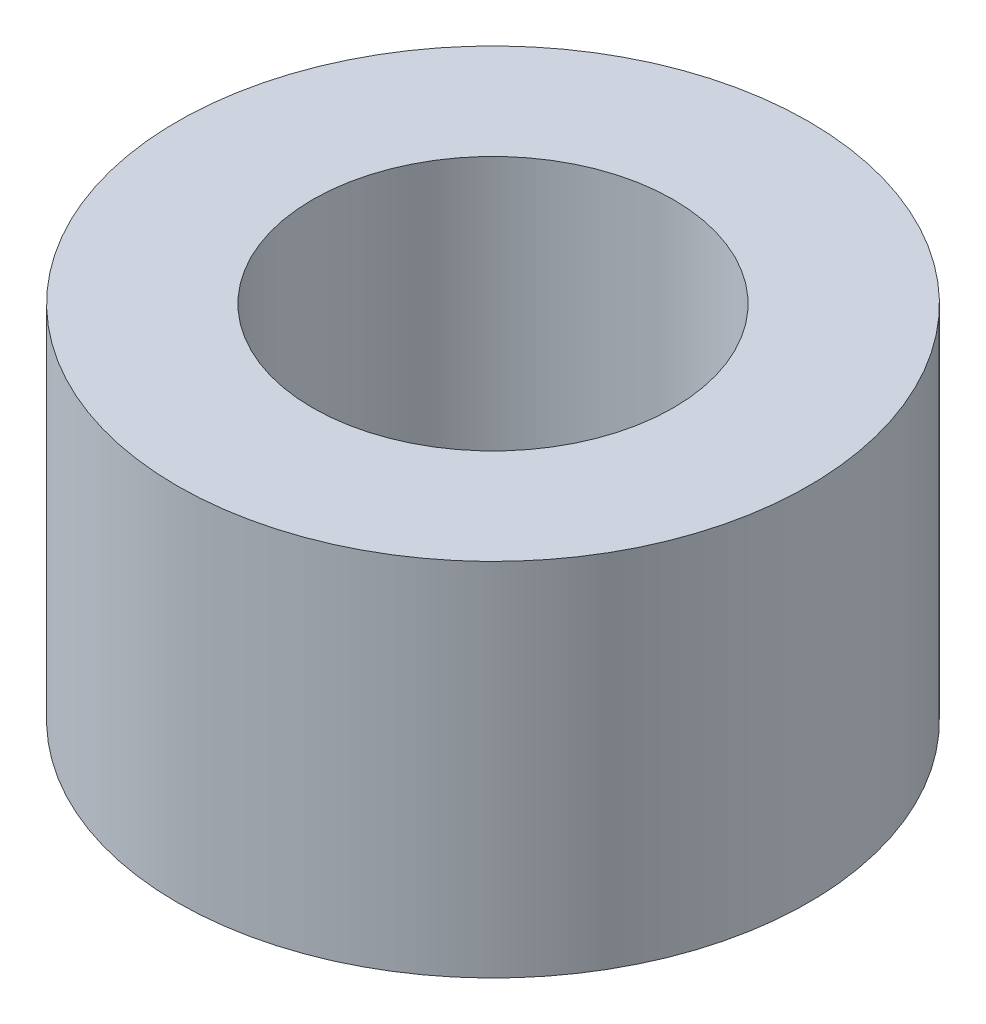
from build123d import *

# Parameters (mm, degrees)
SKETCH1_R           = 17.5
SKETCH1_R_2         = 10
BOSS_EXTRUDE1_DEPTH = 10


with BuildPart() as part:
    # Sketch1 → Boss-Extrude1 (new, symmetric)
    with BuildSketch(Plane(origin=(0, 0, 0), x_dir=(1, 0, 0), z_dir=(0, 1, 0))):
        with Locations(Location((0, 0, 0), (0, 0, 270))):
            Circle(SKETCH1_R)
        with Locations(Location((0, 0, 0), (0, 0, 270))):
            Circle(SKETCH1_R_2, mode=Mode.SUBTRACT)
    extrude(amount=BOSS_EXTRUDE1_DEPTH, both=True)


solid = part.part
